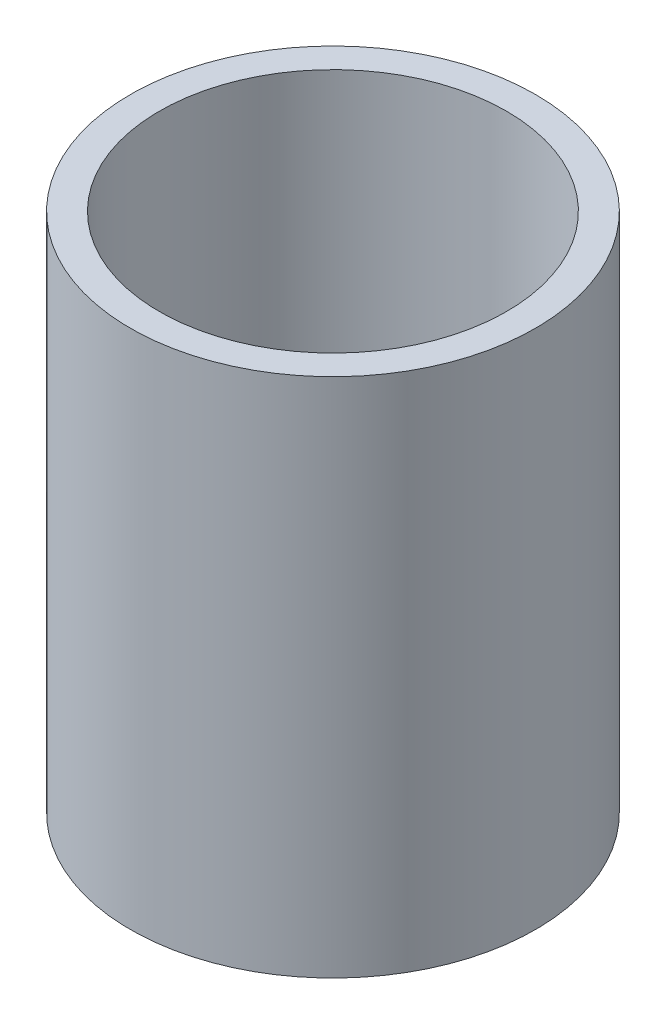
from build123d import *

# Parameters (mm, degrees)
SKETCH_1_R          = 70
EXTRUDE_1_DEPTH     = 180
SKETCH_2_R          = 60
CUT_EXTRUDE_1_DEPTH = 360


with BuildPart() as part:
    # 草图1 → 凸台-拉伸1 (new body)
    with BuildSketch(Plane(origin=(0, 0, 0), x_dir=(1, 0, 0), z_dir=(0, 1, 0))):
        with Locations(Location((0, 0, 0), (0, 0, 90))):
            Circle(SKETCH_1_R)
    extrude(amount=EXTRUDE_1_DEPTH)

    # 草图2 → 切除-拉伸1 (cut)
    with BuildSketch(Plane(origin=(0, 0, 0), x_dir=(1, 0, 0), z_dir=(0, 1, 0))):
        with Locations(Location((0, 0, 0), (0, 0, 90))):
            Circle(SKETCH_2_R)
    extrude(amount=CUT_EXTRUDE_1_DEPTH, mode=Mode.SUBTRACT)


solid = part.part
